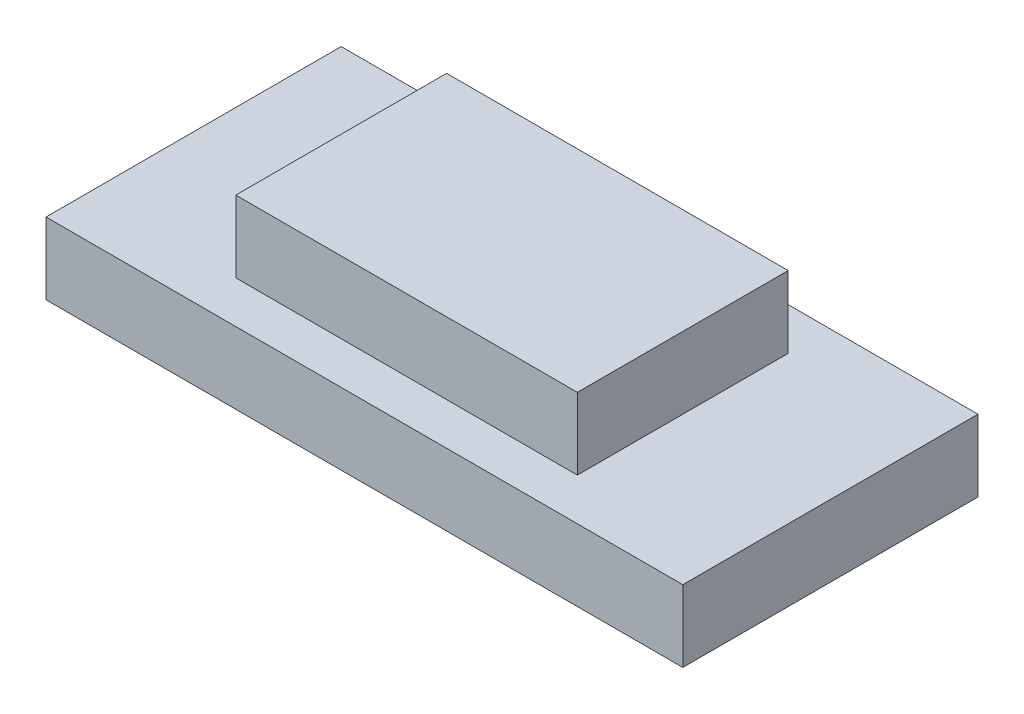
from build123d import *

# Parameters (mm, degrees)
SKETCH1_W           = 151
SKETCH1_H           = 70
BOSS_EXTRUDE1_DEPTH = 17
SKETCH2_W           = 81
SKETCH2_H           = 50
BOSS_EXTRUDE2_DEPTH = 17


with BuildPart() as part:
    # Sketch1 → Boss-Extrude1 (new body)
    with BuildSketch(Plane(origin=(0, 0, 0), x_dir=(1, 0, 0), z_dir=(0, 1, 0))):
        with Locations((75.5, -35)):
            Rectangle(SKETCH1_W, SKETCH1_H)
    extrude(amount=BOSS_EXTRUDE1_DEPTH)

    # Sketch2 → Boss-Extrude2 (add)
    with BuildSketch(Plane(origin=(0, 17, 0), x_dir=(1, 0, 0), z_dir=(0, 1, 0))):
        with Locations((75.5, -35)):
            Rectangle(SKETCH2_W, SKETCH2_H)
    extrude(amount=BOSS_EXTRUDE2_DEPTH)


solid = part.part
